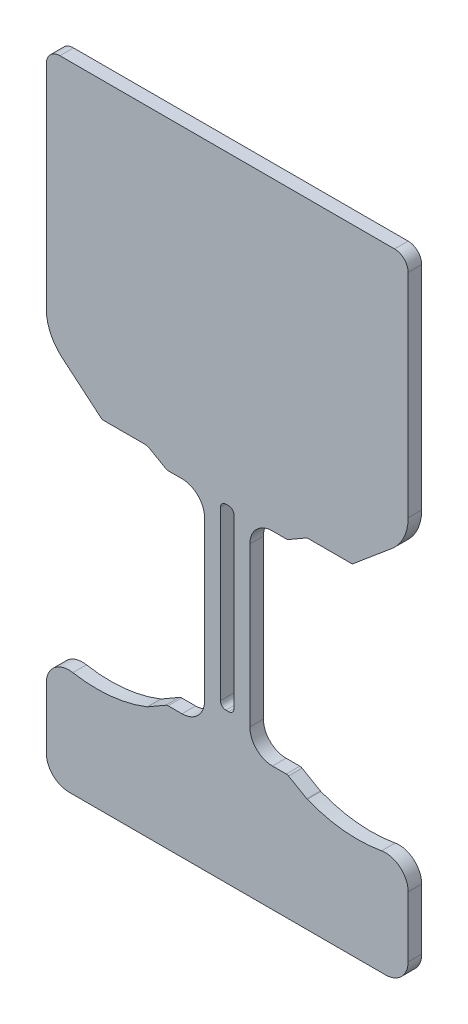
from build123d import *

# Parameters (mm, degrees)
RESSALTO_EXTRUS_O4_DEPTH = 3
CORTE_EXTRUS_O1_DEPTH    = 3


with BuildPart() as part:
    # Esboço2 → Ressalto-extrusão4 (new body)
    with BuildSketch(Plane.XY):
        with BuildLine():
            Line((31.427362324, 25.061276238), (22.653821271, 17.699401176))
            Line((22.653821271, 17.699401176), (12.921770463, 17.699401176))
            ThreePointArc((12.921770463, 17.699401176), (12.662951418, 17.665327003), (12.421770463, 17.56542658))
            Line((12.421770463, 17.56542658), (8.55574506, 15.333375773))
            ThreePointArc((8.55574506, 15.333375773), (8.314564105, 15.23347535), (8.05574506, 15.199401176))
            Line((8.05574506, 15.199401176), (5, 15.199401176))
            ThreePointArc((5, 15.199401176), (1.464466094, 13.734935082), (0, 10.199401176))
            Line((0, 10.199401176), (0, -24.800598824))
            ThreePointArc((0, -24.800598824), (1.464466094, -28.33613273), (5, -29.800598824))
            Line((5, -29.800598824), (8.051923789, -29.800598824))
            ThreePointArc((8.051923789, -29.800598824), (8.310742834, -29.834672997), (8.551923789, -29.93457342))
            Line((8.551923789, -29.93457342), (12.587284274, -32.264389882))
            ThreePointArc((12.587284274, -32.264389882), (12.651697156, -32.298511057), (12.718424432, -32.327849506))
            ThreePointArc((12.718424432, -32.327849506), (20.804137446, -34.299176341), (29.120634875, -33.981757168))
            ThreePointArc((29.120634875, -33.981757168), (33.209608572, -35.069970557), (35, -38.903821469))
            Line((35, -38.903821469), (35, -52.300598824))
            ThreePointArc((35, -52.300598824), (33.535533906, -55.83613273), (30, -57.300598824))
            Line((30, -57.300598824), (-40, -57.300598824))
            ThreePointArc((-40, -57.300598824), (-43.535533906, -55.83613273), (-45, -52.300598824))
            Line((-45, -52.300598824), (-45, -38.903821469))
            ThreePointArc((-45, -38.903821469), (-43.209608572, -35.069970557), (-39.120634875, -33.981757168))
            ThreePointArc((-39.120634875, -33.981757168), (-30.804137446, -34.299176341), (-22.718424432, -32.327849506))
            ThreePointArc((-22.718424432, -32.327849506), (-22.651697156, -32.298511057), (-22.587284274, -32.264389882))
            Line((-22.587284274, -32.264389882), (-18.551923789, -29.93457342))
            ThreePointArc((-18.551923789, -29.93457342), (-18.310742834, -29.834672997), (-18.051923789, -29.800598824))
            Line((-18.051923789, -29.800598824), (-15, -29.800598824))
            ThreePointArc((-15, -29.800598824), (-11.464466094, -28.33613273), (-10, -24.800598824))
            Line((-10, -24.800598824), (-10, 10.199401176))
            ThreePointArc((-10, 10.199401176), (-11.464466094, 13.734935082), (-15, 15.199401176))
            Line((-15, 15.199401176), (-18.05574506, 15.199401176))
            ThreePointArc((-18.05574506, 15.199401176), (-18.314564105, 15.23347535), (-18.55574506, 15.333375773))
            Line((-18.55574506, 15.333375773), (-22.421770463, 17.56542658))
            ThreePointArc((-22.421770463, 17.56542658), (-22.662951418, 17.665327003), (-22.921770463, 17.699401176))
            Line((-22.921770463, 17.699401176), (-32.653821271, 17.699401176))
            Line((-32.653821271, 17.699401176), (-41.427362324, 25.061276238))
            ThreePointArc((-41.427362324, 25.061276238), (-44.062564097, 28.495538052), (-44.999486227, 32.721720669))
            Line((-44.999486227, 32.721720669), (-44.999486227, 77.699401176))
            Line((-44.999486227, 77.699401176), (-44.999486227, 79.699401176))
            ThreePointArc((-44.999486227, 79.699401176), (-44.12080657, 81.82072152), (-41.999486227, 82.699401176))
            Line((-41.999486227, 82.699401176), (-39.999486227, 82.699401176))
            Line((-39.999486227, 82.699401176), (29.999486227, 82.699401176))
            Line((29.999486227, 82.699401176), (31.999486227, 82.699401176))
            ThreePointArc((31.999486227, 82.699401176), (34.12080657, 81.82072152), (34.999486227, 79.699401176))
            Line((34.999486227, 79.699401176), (34.999486227, 77.699401176))
            Line((34.999486227, 77.699401176), (34.999486227, 32.721720669))
            ThreePointArc((34.999486227, 32.721720669), (34.062564097, 28.495538052), (31.427362324, 25.061276238))
        make_face()
    extrude(amount=RESSALTO_EXTRUS_O4_DEPTH)

    # Esboço3 → Corte-extrusão1 (cut)
    with BuildSketch(Plane(origin=(0, 0, 0), x_dir=(-1, 0, 0), z_dir=(0, 0, -1))):
        with BuildLine():
            Line((4.7, 15.199401176), (5.3, 15.199401176))
            ThreePointArc((5.3, 15.199401176), (6.148528137, 14.847929314), (6.5, 13.999401176))
            Line((6.5, 13.999401176), (6.5, -23.050598824))
            ThreePointArc((6.5, -23.050598824), (6.148528137, -23.899126961), (5.3, -24.250598824))
            Line((5.3, -24.250598824), (4.7, -24.250598824))
            ThreePointArc((4.7, -24.250598824), (3.851471863, -23.899126961), (3.5, -23.050598824))
            Line((3.5, -23.050598824), (3.5, 13.999401176))
            ThreePointArc((3.5, 13.999401176), (3.851471863, 14.847929314), (4.7, 15.199401176))
        make_face()
    extrude(amount=-CORTE_EXTRUS_O1_DEPTH, mode=Mode.SUBTRACT)


solid = part.part
